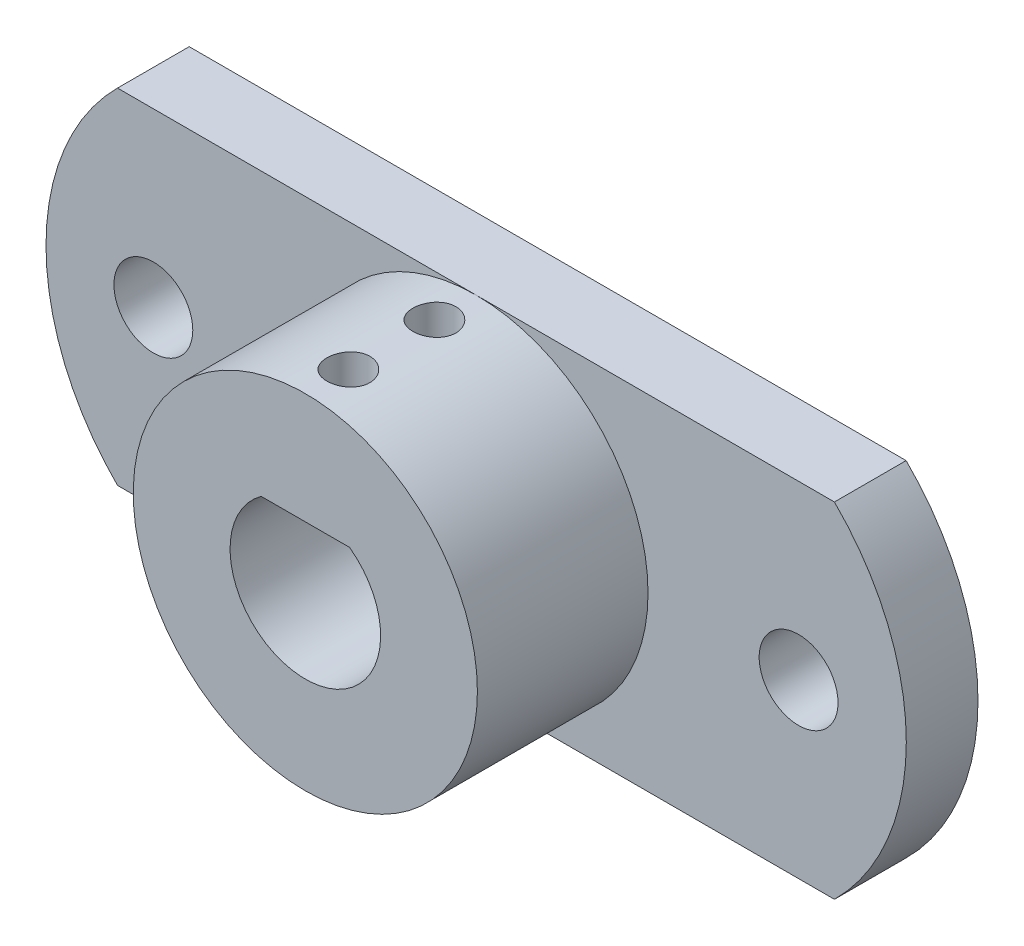
from build123d import *

# Parameters (mm, degrees)
SKETCH_1_R          = 2.75
EXTRUDE_1_DEPTH     = 2.5
SKETCH_2_R          = 12
EXTRUDE_2_DEPTH     = 11.9
CUT_EXTRUDE_1_DEPTH = 11.9
SKETCH_4_R          = 1.5
CUT_EXTRUDE_2_DEPTH = 38.043126228


with BuildPart() as part:
    # 草图1 → 凸台-拉伸1 (new, symmetric)
    with BuildSketch(Plane.XY):
        with BuildLine():
            Line((-25, 0), (25, 0))
            ThreePointArc((25, 0), (30.012842263, -12), (25, -24))
            Line((25, -24), (-25, -24))
            ThreePointArc((-25, -24), (-29.987157737, -12), (-25, 0))
        make_face()
        with Locations((-22.5, -12)):
            Circle(SKETCH_1_R, mode=Mode.SUBTRACT)
        with Locations((22.5, -12)):
            Circle(SKETCH_1_R, mode=Mode.SUBTRACT)
    extrude(amount=EXTRUDE_1_DEPTH, both=True)

    # 草图2 → 凸台-拉伸2 (add)
    with BuildSketch(Plane.XY.offset(2.5)):
        with Locations(Location((0, -12, 0), (0, 0, 270))):
            Circle(SKETCH_2_R)
    extrude(amount=EXTRUDE_2_DEPTH)

    # 草图3 → 切除-拉伸1 (cut)
    with BuildSketch(Plane.XY.offset(14.4)):
        with BuildLine():
            Line((-3.082207001, -7.75), (3.082207001, -7.75))
            ThreePointArc((3.082207001, -7.75), (0, -17.25), (-3.082207001, -7.75))
        make_face()
    extrude(amount=-CUT_EXTRUDE_1_DEPTH, mode=Mode.SUBTRACT)

    # 草图4 → 切除-拉伸2 (cut, through all)
    with BuildSketch(Plane.XZ.offset(7.75)):
        with Locations(Location((0, 11.4, 0), (0, 0, 270))):
            Circle(SKETCH_4_R)
        with Locations(Location((0, 5.4, 0), (0, 0, 270))):
            Circle(SKETCH_4_R)
    extrude(amount=-CUT_EXTRUDE_2_DEPTH, mode=Mode.SUBTRACT)


solid = part.part
